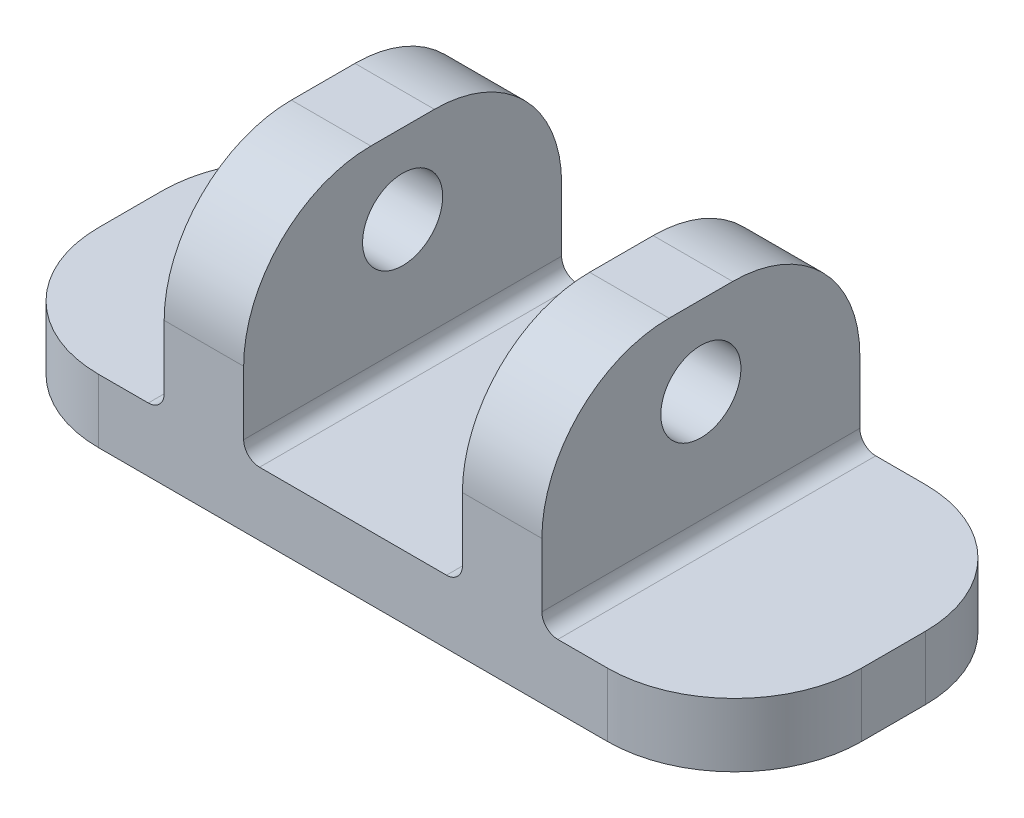
from build123d import *

# Parameters (mm, degrees)
BOSS_EXTRUDE1_DEPTH     = 15.875
CUT_EXTRUDE1_DEPTH      = 46.459081876
CUT_EXTRUDE1_DEPTH_BACK = 46.459081876
SKETCH2_R               = 4
FILLET1_R               = 12.7
FILLET2_R               = 1.5875
FILLET3_R               = 12.7


with BuildPart() as part:
    # Sketch1 → Boss-Extrude1 (new, symmetric)
    with BuildSketch(Plane.XY):
        Polygon((10.922, 7.9375), (18.8595, 7.9375), (18.8595, -12.7), (38.1, -12.7), (38.1, -19.05), (-38.1, -19.05), (-38.1, -12.7), (-18.8595, -12.7), (-18.8595, 7.9375), (-10.922, 7.9375), (-10.922, -12.7), (10.922, -12.7), align=None)
    extrude(amount=BOSS_EXTRUDE1_DEPTH, both=True)

    # Sketch2 → Cut-Extrude1 (cut, two sides: drawn at the far end of the back side and taken through both)
    with BuildSketch(Plane(origin=(0, 0, 0), x_dir=(0, 0, -1), z_dir=(1, 0, 0)).offset(-CUT_EXTRUDE1_DEPTH_BACK)):
        with Locations(Location((0, 0, 0), (0, 0, 90))):
            Circle(SKETCH2_R)
    extrude(amount=CUT_EXTRUDE1_DEPTH + CUT_EXTRUDE1_DEPTH_BACK, mode=Mode.SUBTRACT)

    # Fillet1
    fillet1_edges = [part.edges().sort_by_distance(p)[0] for p in [
        (14.89075, 7.9375, -15.875),
        (-14.89075, 7.9375, 15.875),
        (-14.89075, 7.9375, -15.875),
        (14.89075, 7.9375, 15.875),
    ]]
    fillet(fillet1_edges, radius=FILLET1_R)

    # Fillet2
    fillet2_edges = [part.edges().sort_by_distance(p)[0] for p in [
        (18.8595, -12.7, 0),
        (-18.8595, -12.7, 0),
        (-10.922, -12.7, 0),
        (10.922, -12.7, 0),
    ]]
    fillet(fillet2_edges, radius=FILLET2_R)

    # Fillet3
    fillet3_edges = [part.edges().sort_by_distance(p)[0] for p in [
        (38.1, -15.875, -15.875),
        (-38.1, -15.875, -15.875),
        (-38.1, -15.875, 15.875),
        (38.1, -15.875, 15.875),
    ]]
    fillet(fillet3_edges, radius=FILLET3_R)


solid = part.part
